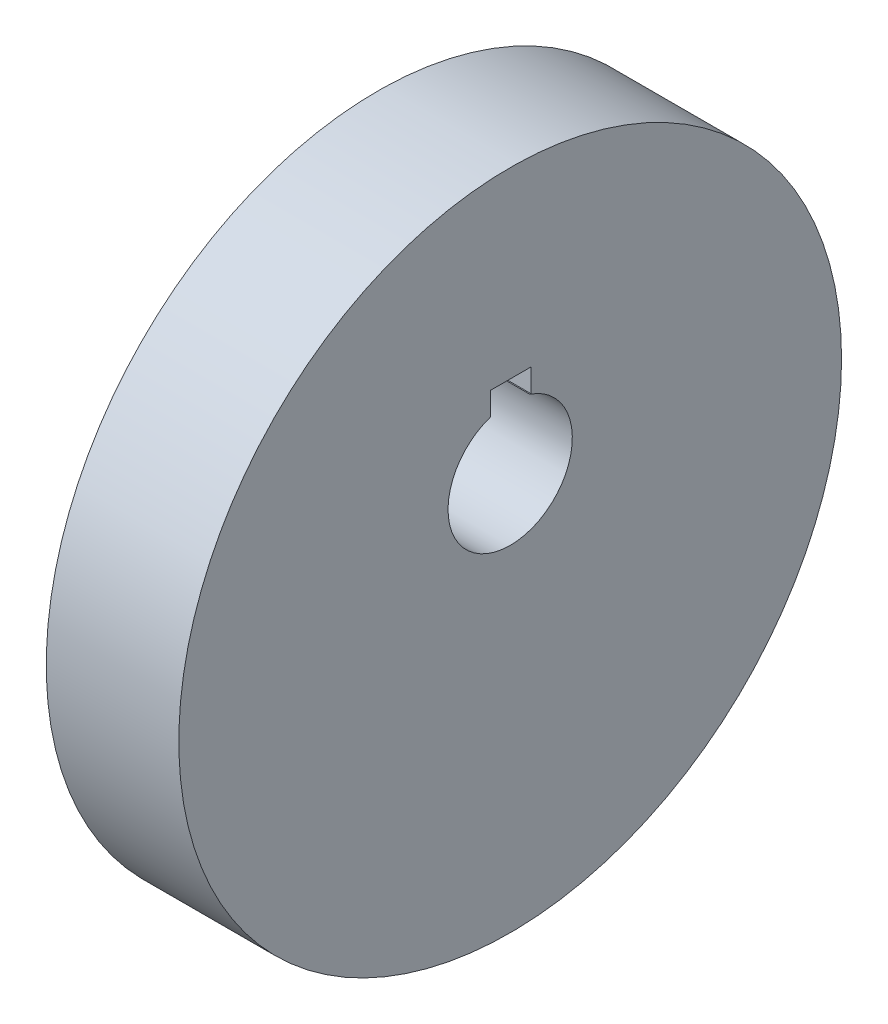
from build123d import *

# Parameters (mm, degrees)
SKETCH1_R           = 25.4
BOSS_EXTRUDE1_DEPTH = 10.16
SKETCH2_R           = 4.7625
CUT_EXTRUDE1_DEPTH  = 38.33022368
SKETCH3_W           = 1.768395793
SKETCH3_H           = 3.093534736
CUT_EXTRUDE2_DEPTH  = 38.33022368


with BuildPart() as part:
    # Sketch1 → Boss-Extrude1 (new body)
    with BuildSketch(Plane.YZ):
        with Locations(Location((0, 0, 0), (0, 0, 270))):
            Circle(SKETCH1_R)
    extrude(amount=BOSS_EXTRUDE1_DEPTH)

    # Sketch2 → Cut-Extrude1 (cut, through all)
    with BuildSketch(Plane.YZ):
        with Locations(Location((5.08, 0, 0), (0, 0, 270))):
            Circle(SKETCH2_R)
    extrude(amount=CUT_EXTRUDE1_DEPTH, mode=Mode.SUBTRACT)

    # Sketch3 → Cut-Extrude2 (cut, through all)
    with BuildSketch(Plane.YZ):
        with Locations((10.482302104, -0.040732632)):
            Rectangle(SKETCH3_W, SKETCH3_H)
    extrude(amount=CUT_EXTRUDE2_DEPTH, mode=Mode.SUBTRACT)


solid = part.part
